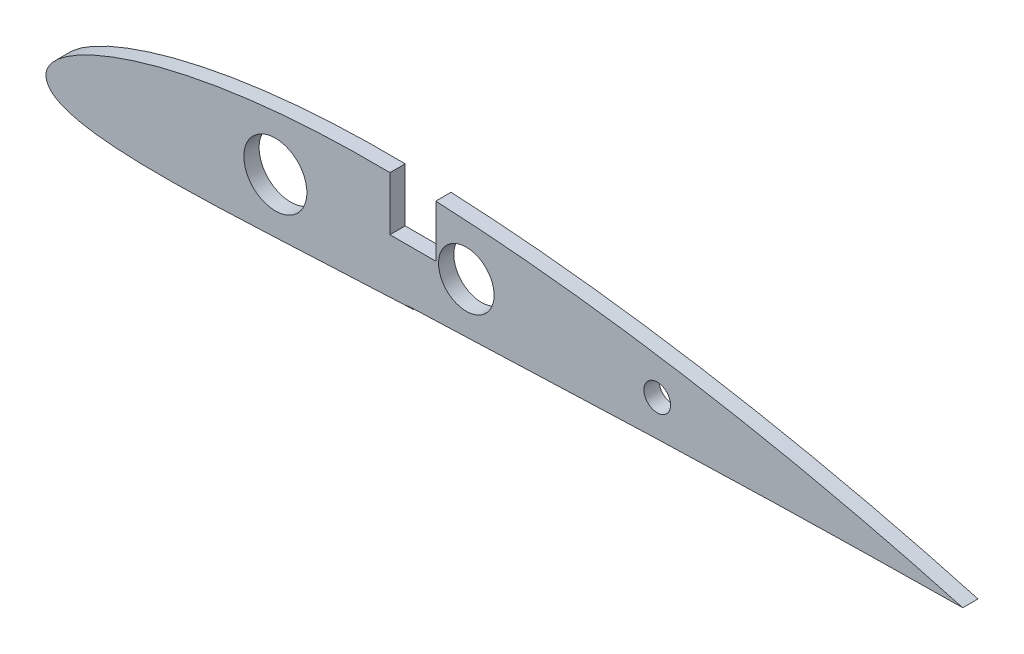
from build123d import *

# Parameters (mm, degrees)
EXTRUDE_1_DEPTH     = 4
SKETCH_2_R          = 8.2578
CUT_EXTRUDE_1_DEPTH = 242.202599346
SKETCH_3_R          = 7.275764765
CUT_EXTRUDE_2_DEPTH = 242.202599346
SKETCH_4_R          = 3.49305919
CUT_EXTRUDE_3_DEPTH = 242.202599346
SKETCH_5_W          = 12
SKETCH_5_H          = 20.4
CUT_EXTRUDE_4_DEPTH = 242.202599346


with BuildPart() as part:
    # 草图1 → 凸台-拉伸1 (new body)
    with BuildSketch(Plane.XY):
        with BuildLine():
            add(Edge.make_bspline(
                [(240, 0), (238.17502762, 0.503877157), (234.552675186, 1.504013196), (229.144749778, 2.936711102), (223.80806151, 4.308267422), (218.540948315, 5.617098938), (213.343197185, 6.866529147), (208.214254003, 8.058388035), (203.15369138, 9.194718503), (198.161080577, 10.277336529), (193.236020433, 11.307957122), (188.378126395, 12.288176228), (183.587030984, 13.219487875), (178.862381096, 14.103288415), (174.20383633, 14.94088935), (169.611066641, 15.733517024), (165.083753424, 16.48233437), (160.621585255, 17.188430181), (156.224259941, 17.852838479), (151.891482042, 18.476541482), (147.622963921, 19.060474437), (143.418423037, 19.605526314), (139.277584839, 20.112556204), (135.200180439, 20.582388904), (131.185946744, 21.015818963), (127.234627591, 21.413621778), (123.345973004, 21.776552314), (119.519739391, 22.105341593), (115.755690711, 22.400727766), (112.053595721, 22.663373335), (108.413239177, 22.894176737), (104.834380856, 23.09312439), (101.31690831, 23.263502654), (98.991812062, 23.353021494), (97.839651, 23.397381)],
                knots=[0, 0, 0, 0, 0.039336668, 0.078078592, 0.116236834, 0.153821599, 0.190842315, 0.227307743, 0.263226027, 0.298604748, 0.333451008, 0.367771481, 0.401572442, 0.434859826, 0.467639254, 0.499916089, 0.53169544, 0.562982199, 0.593781082, 0.62409661, 0.653933172, 0.683295, 0.712186209, 0.740610792, 0.768572632, 0.796075522, 0.823123146, 0.849719099, 0.87586689, 0.901569938, 0.926831572, 0.951655041, 0.976043495, 1, 1, 1, 1], degree=3))
            add(Edge.make_bspline(
                [(97.839651, 23.397381), (97.226966307, 23.449039102), (96.614219107, 23.500702474), (95.999811647, 23.51949076), (95.999560338, 23.519500462), (95.999120662, 23.519516542), (95.998241355, 23.51954958), (95.996482988, 23.519613016), (95.992966008, 23.519741888), (95.985932345, 23.519998315), (95.971865659, 23.520510119), (95.943736443, 23.521535357), (95.887493304, 23.523574403), (95.775067579, 23.527626449), (95.550458266, 23.535617202), (95.102207861, 23.551142578), (94.209582037, 23.580385825), (92.439845376, 23.631737223), (89.936085165, 23.685664421), (86.966992664, 23.719873594), (84.045559907, 23.724232935), (81.17204691, 23.699658881), (78.346701734, 23.647058523), (75.569762496, 23.567335691), (72.841456217, 23.461398305), (70.161999702, 23.330141011), (67.531597571, 23.174466006), (64.95044447, 22.995263944), (62.418723463, 22.793422793), (59.936605574, 22.569833811), (57.504251516, 22.325372701), (55.12180932, 22.06092015), (52.789416328, 21.777345145), (50.507198451, 21.475512573), (48.275269484, 21.156284343), (46.093732456, 20.820512998), (43.962679202, 20.469041082), (41.882190516, 20.102709676), (39.852336011, 19.722346633), (37.873174485, 19.328773149), (35.944754253, 18.922799873), (34.0671133, 18.505228482), (32.240279689, 18.076847911), (30.464271312, 17.638437807), (28.739096854, 17.190765253), (27.064755379, 16.734584348), (25.441236471, 16.270638001), (23.86852294, 15.799649451), (22.346586305, 15.322338273), (20.875393699, 14.839395746), (19.454901269, 14.351509133), (18.085059478, 13.859344064), (16.765811981, 13.363548129), (15.497095001, 12.86475515), (14.278838907, 12.363578802), (13.110967321, 11.860617848), (11.993400347, 11.356444633), (10.926050231, 10.851619269), (9.908825297, 10.346679325), (8.941629343, 9.842141012), (8.024362218, 9.338498323), (7.156916873, 8.836227353), (6.339185804, 8.335776371), (5.571054955, 7.837575288), (4.852407002, 7.342028613), (4.183123727, 6.849513508), (3.563081387, 6.360384134), (2.992153385, 5.874967569), (2.470213127, 5.393559867), (1.997132785, 4.916427887), (1.572785196, 4.443807495), (1.197048819, 3.975898622), (0.869815163, 3.512865181), (0.590983079, 3.05484006), (0.360493175, 2.601923891), (0.178281873, 2.154192638), (0.044447501, 1.711745574), (-0.041317513, 1.274616255), (-0.077768968, 0.843189571), (-0.069253211, 0.416782674), (-0.023049702, 0.138718712), (0, 0)],
                knots=[0, 0, 0, 0, 0.017582927, 0.017584721, 0.017586524, 0.017590122, 0.017597308, 0.017611699, 0.017640462, 0.017697998, 0.017813068, 0.018043181, 0.018503318, 0.019423259, 0.021261803, 0.024933523, 0.032255526, 0.046813772, 0.075587352, 0.103904181, 0.131764656, 0.15916911, 0.186117882, 0.212611277, 0.238649567, 0.264233038, 0.289361946, 0.314036548, 0.338257085, 0.362023807, 0.385336967, 0.408196806, 0.430603595, 0.452557604, 0.474059098, 0.495108395, 0.515705802, 0.535851653, 0.5555463, 0.574790153, 0.593583618, 0.611927145, 0.629821241, 0.647266438, 0.664263315, 0.680812518, 0.696914758, 0.71257079, 0.727781465, 0.742547712, 0.756870557, 0.770751127, 0.784190676, 0.797190607, 0.809752443, 0.82187792, 0.83356895, 0.844827698, 0.855656579, 0.86605831, 0.876035987, 0.88559311, 0.894733667, 0.90346222, 0.911784009, 0.91970509, 0.927232459, 0.934374289, 0.941140136, 0.947541203, 0.953590719, 0.959304321, 0.96470053, 0.969801286, 0.974632512, 0.979224624, 0.983612928, 0.987837766, 0.991944216, 0.995981184, 1, 1, 1, 1], degree=3))
            add(Edge.make_bspline(
                [(0, 0), (0.032076521, -0.13691234), (0.096372164, -0.41134568), (0.252263385, -0.808249044), (0.451122139, -1.192622996), (0.69700614, -1.563551239), (0.988428719, -1.92129973), (1.325470715, -2.265889289), (1.707830218, -2.597453587), (2.135369336, -2.916109668), (2.607944078, -3.221977371), (3.125444179, -3.515158656), (3.687763801, -3.795749274), (4.294807935, -4.06382671), (4.946480007, -4.319465862), (5.642683289, -4.56273801), (6.383322015, -4.793706396), (7.168297169, -5.012439824), (7.997510637, -5.219004038), (8.870863998, -5.413468384), (9.788258839, -5.595905068), (10.749597368, -5.766393087), (11.754783929, -5.925012238), (12.80372392, -6.071852048), (13.896326279, -6.20700313), (15.03250273, -6.330565391), (16.212168398, -6.442646554), (17.435242528, -6.543362452), (18.70164871, -6.632831224), (20.011315794, -6.711188759), (21.364177656, -6.778571473), (22.760174201, -6.835130772), (24.199251318, -6.881025382), (25.681361566, -6.916429589), (27.206464919, -6.941520357), (28.774527995, -6.956497223), (30.385526154, -6.961562921), (32.039442244, -6.956939132), (33.736267756, -6.942859097), (35.476002731, -6.919568942), (37.258656961, -6.887336234), (39.084249281, -6.846431872), (40.952808512, -6.797158584), (42.864373386, -6.739820317), (44.818992939, -6.674750629), (46.816726763, -6.602296183), (48.857644498, -6.522816498), (50.941828345, -6.436704019), (53.069369863, -6.344356166), (55.240372802, -6.246201986), (57.454951474, -6.142682478), (59.713232279, -6.034268246), (62.015352511, -5.921443226), (64.361461256, -5.804722162), (66.751718806, -5.684634046), (69.186297284, -5.561739751), (71.665379639, -5.436614277), (74.189160956, -5.309864833), (76.757846377, -5.182117382), (79.371652787, -5.054022914), (82.030807732, -4.926257095), (84.73554955, -4.799522903), (87.486127142, -4.674544836), (90.282798977, -4.552071591), (92.642339394, -4.453149116), (94.310976431, -4.385795256), (95.152933321, -4.352501022), (95.575827168, -4.335958114), (95.787753729, -4.327713039), (95.893836919, -4.323595898), (95.946908648, -4.321539514), (95.973451655, -4.320511682), (95.986725325, -4.319998128), (95.993362343, -4.319741909), (95.996681321, -4.31961303), (95.998340689, -4.319549549), (95.999170328, -4.319516576), (95.999585007, -4.319500464), (95.999821974, -4.31949074), (96.614265681, -4.299682778), (95.387248082, -4.248529419), (94.160349, -4.197381)],
                knots=[0, 0, 0, 0, 0.004211936, 0.008442597, 0.012745008, 0.017169257, 0.021761069, 0.026561038, 0.031604396, 0.036921232, 0.042536951, 0.048472805, 0.054746572, 0.061373036, 0.068364506, 0.075731265, 0.08348188, 0.091623508, 0.100162165, 0.109102894, 0.118449932, 0.128206846, 0.138376653, 0.148961891, 0.159964697, 0.171386903, 0.183230054, 0.195495446, 0.208184214, 0.221297298, 0.234835543, 0.248799652, 0.263190262, 0.278007943, 0.293253202, 0.308926527, 0.325028363, 0.341559171, 0.358519389, 0.375909461, 0.393729869, 0.411981116, 0.43066372, 0.449778258, 0.46932536, 0.489305671, 0.509719931, 0.530568926, 0.551853524, 0.573574631, 0.595733264, 0.618330507, 0.641367513, 0.664845549, 0.688765955, 0.713130163, 0.73793972, 0.763196258, 0.788901524, 0.81505735, 0.841665711, 0.868728677, 0.896248423, 0.924227279, 0.95266766, 0.967061719, 0.974302362, 0.977933601, 0.979751957, 0.980661821, 0.981116917, 0.981344515, 0.981458314, 0.981515228, 0.981543676, 0.981557909, 0.981565021, 0.981568572, 0.981570353, 0.981572133, 1, 1, 1, 1], degree=3))
            add(Edge.make_bspline(
                [(94.160349, -4.197381), (95.353940767, -4.155227461), (97.763015391, -4.070147265), (101.409211271, -3.936336063), (105.120752046, -3.797271169), (108.897416594, -3.653121285), (112.738995118, -3.504606578), (116.645264344, -3.352316109), (120.615996167, -3.196895567), (124.650953948, -3.038988445), (128.749894718, -2.879255578), (132.912568867, -2.718356211), (137.138720999, -2.556957029), (141.428088913, -2.395720601), (145.780404472, -2.235306022), (150.195392741, -2.076360401), (154.672773676, -1.919522787), (159.212259498, -1.765403314), (163.813556162, -1.614598923), (168.47636194, -1.467667479), (173.20036748, -1.325131951), (177.985254586, -1.187478891), (182.830695046, -1.055134634), (187.736349264, -0.928478427), (192.701865657, -0.807814836), (197.726878229, -0.693385327), (202.811005017, -0.585338659), (207.953845588, -0.48374147), (213.154977694, -0.388553332), (218.413955211, -0.299632134), (223.73030432, -0.216683041), (229.103521669, -0.139399485), (234.53306244, -0.066869757), (238.171498969, -0.022365615), (240, 0)],
                knots=[0, 0, 0, 0, 0.024556932, 0.049564251, 0.075020475, 0.100924071, 0.127273404, 0.1540668, 0.181302523, 0.208978784, 0.23709373, 0.26564548, 0.294632117, 0.324051674, 0.353902153, 0.384181539, 0.414887763, 0.446018758, 0.477572404, 0.509546548, 0.541939027, 0.574747624, 0.607970061, 0.641604036, 0.675647154, 0.710096952, 0.744950883, 0.780206276, 0.815860328, 0.851910079, 0.888352393, 0.925183922, 0.962401082, 1, 1, 1, 1], degree=3))
        make_face()
    extrude(amount=EXTRUDE_1_DEPTH)

    # 草图2 → 切除-拉伸1 (cut, through all)
    with BuildSketch(Plane.XY):
        with Locations((60, 8.25)):
            Circle(SKETCH_2_R)
    extrude(amount=CUT_EXTRUDE_1_DEPTH, mode=Mode.SUBTRACT)

    # 草图3 → 切除-拉伸2 (cut, through all)
    with BuildSketch(Plane.XY):
        with Locations((110, 9.50926)):
            Circle(SKETCH_3_R)
    extrude(amount=CUT_EXTRUDE_2_DEPTH, mode=Mode.SUBTRACT)

    # 草图4 → 切除-拉伸3 (cut, through all)
    with BuildSketch(Plane.XY):
        with Locations((160, 7.703706)):
            Circle(SKETCH_4_R)
    extrude(amount=CUT_EXTRUDE_3_DEPTH, mode=Mode.SUBTRACT)

    # 草图5 → 切除-拉伸4 (cut, through all)
    with BuildSketch(Plane.XY):
        with Locations((96, 19.8)):
            Rectangle(SKETCH_5_W, SKETCH_5_H)
    extrude(amount=CUT_EXTRUDE_4_DEPTH, mode=Mode.SUBTRACT)


solid = part.part
